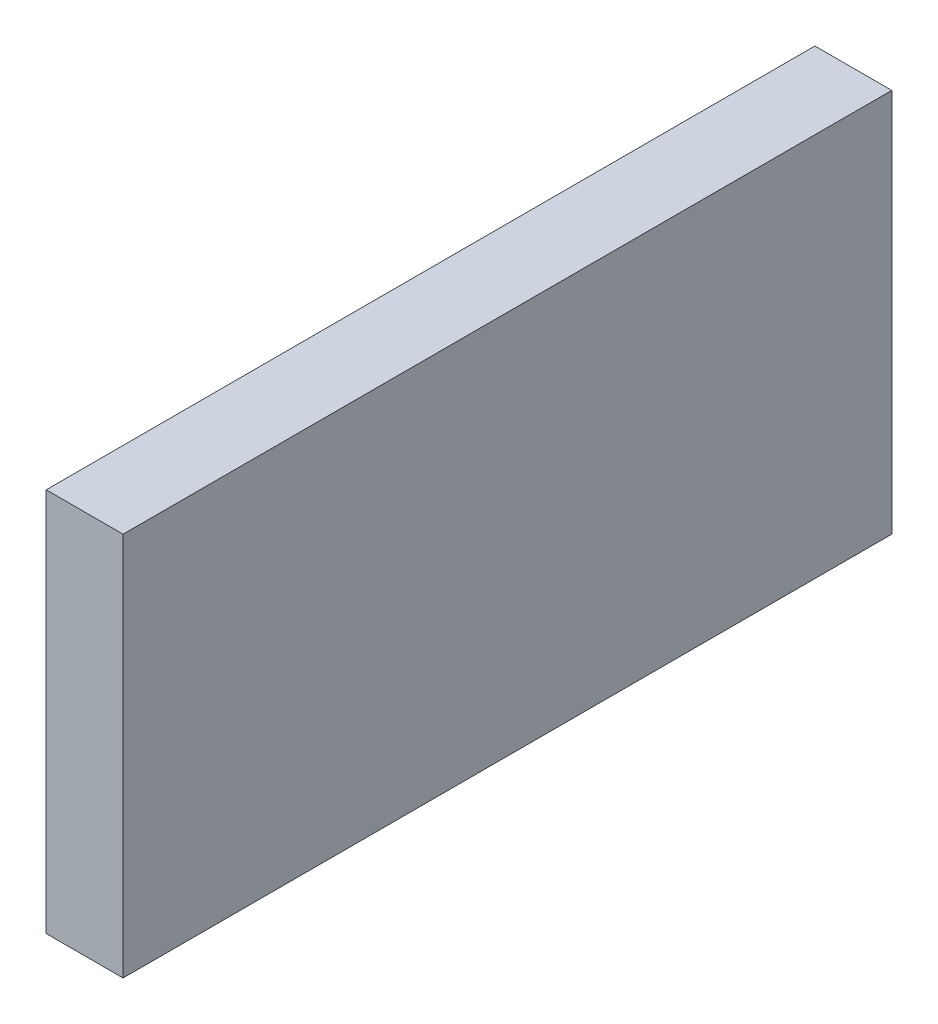
from build123d import *

# Parameters (mm, degrees)
SKETCH1_W           = 40
SKETCH1_H           = 20
BOSS_EXTRUDE1_DEPTH = 4


with BuildPart() as part:
    # Sketch1 → Boss-Extrude1 (new body)
    with BuildSketch(Plane(origin=(0, 0, 0), x_dir=(0, 0, -1), z_dir=(1, 0, 0))):
        with Locations((20, 10)):
            Rectangle(SKETCH1_W, SKETCH1_H)
    extrude(amount=-BOSS_EXTRUDE1_DEPTH)


solid = part.part
